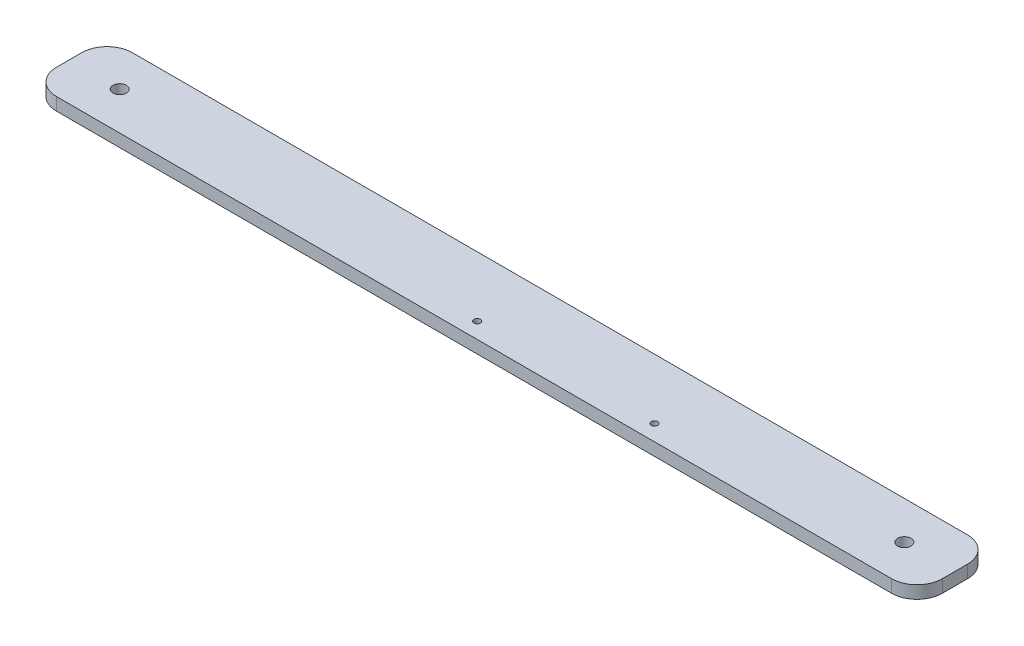
from build123d import *

# Parameters (mm, degrees)
SKETCH1_W                                      = 444.5
SKETCH1_H                                      = 38.1
BOSS_EXTRUDE1_DEPTH                            = 6.35
FILLET1_R                                      = 12.7
FILLET2_R                                      = 12.7
FILLET3_R                                      = 12.7
FILLET4_R                                      = 12.7
SKETCH2_R                                      = 3.3782
CUT_EXTRUDE1_DEPTH                             = 447.175058133
SKETCH4_R                                      = 3.3782
CUT_EXTRUDE2_DEPTH                             = 447.175058133
CSK_FOR_4_FLAT_HEAD_MACHINE_SCREW1_D           = 3.2639
CSK_FOR_4_FLAT_HEAD_MACHINE_SCREW1_CSINK_D     = 5.715
CSK_FOR_4_FLAT_HEAD_MACHINE_SCREW1_CSINK_ANGLE = 82


with BuildPart() as part:
    # Sketch1 → Boss-Extrude1 (new body)
    with BuildSketch(Plane(origin=(0, 0, 0), x_dir=(1, 0, 0), z_dir=(0, 1, 0))):
        with Locations((222.25, 19.05)):
            Rectangle(SKETCH1_W, SKETCH1_H)
    extrude(amount=BOSS_EXTRUDE1_DEPTH)

    # Fillet1
    fillet1_edges = [part.edges().sort_by_distance(p)[0] for p in [
        (0, 3.175, 0),
    ]]
    fillet(fillet1_edges, radius=FILLET1_R)

    # Fillet2
    fillet2_edges = [part.edges().sort_by_distance(p)[0] for p in [
        (0, 3.175, -38.1),
    ]]
    fillet(fillet2_edges, radius=FILLET2_R)

    # Fillet3
    fillet3_edges = [part.edges().sort_by_distance(p)[0] for p in [
        (444.5, 3.175, -38.1),
    ]]
    fillet(fillet3_edges, radius=FILLET3_R)

    # Fillet4
    fillet4_edges = [part.edges().sort_by_distance(p)[0] for p in [
        (444.5, 3.175, 0),
    ]]
    fillet(fillet4_edges, radius=FILLET4_R)

    # Sketch2 → Cut-Extrude1 (cut, through all)
    with BuildSketch(Plane(origin=(0, 6.35, 0), x_dir=(1, 0, 0), z_dir=(0, 1, 0))):
        with Locations(Location((25.4, 19.05, 0), (0, 0, 270))):
            Circle(SKETCH2_R)
    extrude(amount=-CUT_EXTRUDE1_DEPTH, mode=Mode.SUBTRACT)

    # Sketch4 → Cut-Extrude2 (cut, through all)
    with BuildSketch(Plane(origin=(0, 6.35, 0), x_dir=(1, 0, 0), z_dir=(0, 1, 0))):
        with Locations(Location((419.1, 19.05, 0), (0, 0, 270))):
            Circle(SKETCH4_R)
    extrude(amount=-CUT_EXTRUDE2_DEPTH, mode=Mode.SUBTRACT)

    # CSK for #4 Flat Head Machine Screw1 (through all)
    with Locations(Plane(origin=(0, 0, 0), x_dir=(-1, 0, 0), z_dir=(0, -1, 0))):
        with Locations((-304.8, 7.9375), (-215.9, 7.9375)):
            CounterSinkHole(CSK_FOR_4_FLAT_HEAD_MACHINE_SCREW1_D / 2, CSK_FOR_4_FLAT_HEAD_MACHINE_SCREW1_CSINK_D / 2, counter_sink_angle=CSK_FOR_4_FLAT_HEAD_MACHINE_SCREW1_CSINK_ANGLE)


solid = part.part
